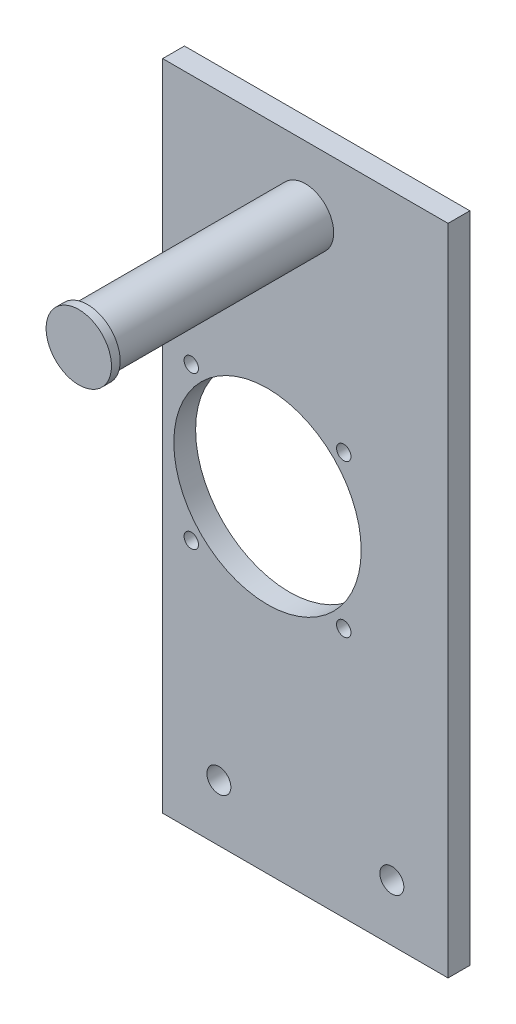
from build123d import *

# Parameters (mm, degrees)
SKETCH1_W           = 65.5
SKETCH1_H           = 150
SKETCH1_R           = 2.75
BOSS_EXTRUDE1_DEPTH = 5
SKETCH2_R           = 6.5
BOSS_EXTRUDE2_DEPTH = 50
SKETCH3_R           = 7.5
BOSS_EXTRUDE3_DEPTH = 2
SKETCH4_R           = 1.65
SKETCH4_R_2         = 21.5
CUT_EXTRUDE1_DEPTH  = 100.732454597


with BuildPart() as part:
    # Sketch1 → Boss-Extrude1 (new body)
    with BuildSketch(Plane.XY):
        Rectangle(SKETCH1_W, SKETCH1_H)
        with Locations((-19.85, -62)):
            Circle(SKETCH1_R, mode=Mode.SUBTRACT)
        with Locations((19.85, -62)):
            Circle(SKETCH1_R, mode=Mode.SUBTRACT)
    extrude(amount=BOSS_EXTRUDE1_DEPTH)

    # Sketch2 → Boss-Extrude2 (add)
    with BuildSketch(Plane.XY.offset(5)):
        with Locations((0, 60)):
            Circle(SKETCH2_R)
    extrude(amount=BOSS_EXTRUDE2_DEPTH)

    # Sketch3 → Boss-Extrude3 (add)
    with BuildSketch(Plane.XY.offset(55)):
        with Locations((0, 60)):
            Circle(SKETCH3_R)
    extrude(amount=BOSS_EXTRUDE3_DEPTH)

    # Sketch4 → Cut-Extrude1 (cut, through all)
    with BuildSketch(Plane(origin=(0, 0, 0), x_dir=(-1, 0, 0), z_dir=(0, 0, -1))):
        with Locations((26.187094913, 17.5)):
            Circle(SKETCH4_R)
        with Locations((-8.812905087, 17.5)):
            Circle(SKETCH4_R)
        with Locations((-8.812905087, -17.5)):
            Circle(SKETCH4_R)
        with Locations((26.187094913, -17.5)):
            Circle(SKETCH4_R)
        with Locations((8.687094913, 0)):
            Circle(SKETCH4_R_2)
    extrude(amount=-CUT_EXTRUDE1_DEPTH, mode=Mode.SUBTRACT)


solid = part.part
